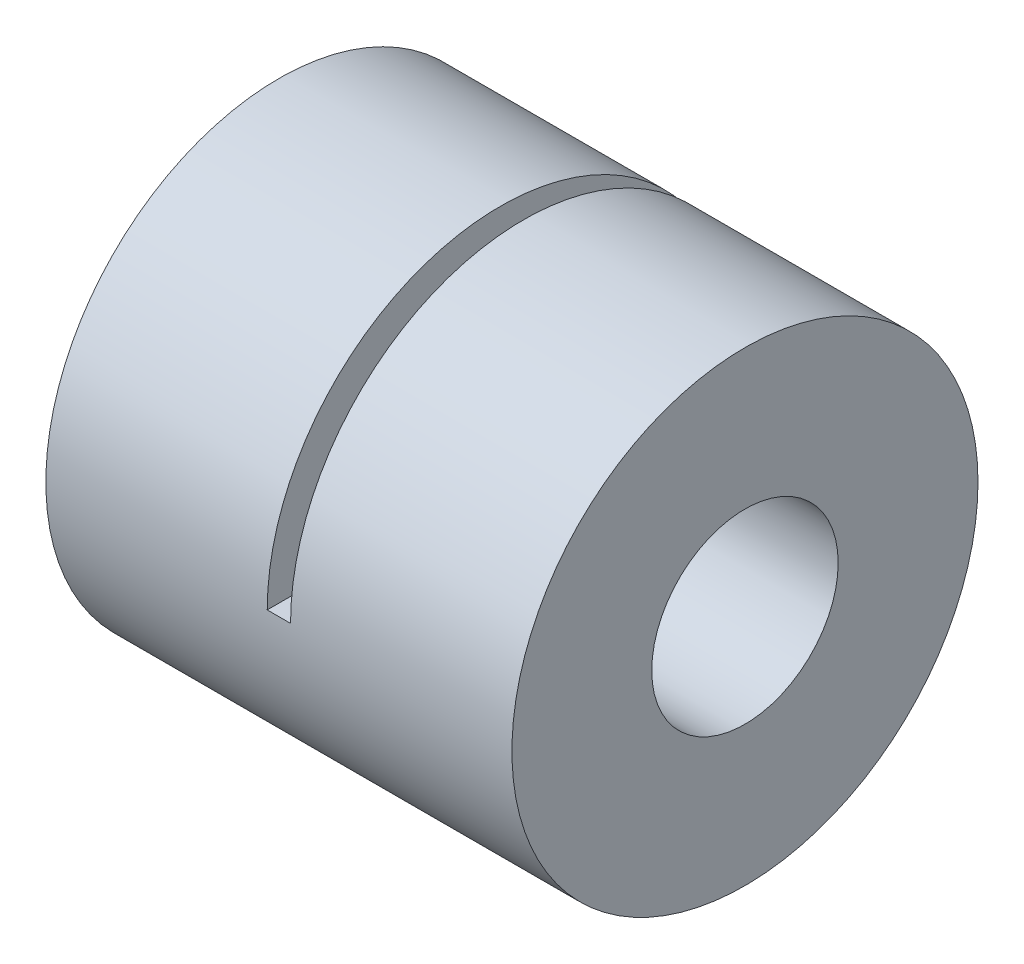
from build123d import *

# Parameters (mm, degrees)
SKETCH_1_R          = 10
SKETCH_1_R_2        = 4
EXTRUDE_1_DEPTH     = 20
SKETCH_2_W          = 1
SKETCH_2_H          = 20
CUT_EXTRUDE_1_DEPTH = 25.494897428


with BuildPart() as part:
    # ｽｹｯﾁ1 → ﾎﾞｽ - 押し出し1 (new body)
    with BuildSketch(Plane(origin=(0, 0, 0), x_dir=(0, 0, -1), z_dir=(1, 0, 0))):
        Circle(SKETCH_1_R)
        Circle(SKETCH_1_R_2, mode=Mode.SUBTRACT)
    extrude(amount=EXTRUDE_1_DEPTH)

    # ｽｹｯﾁ2 → ｶｯﾄ - 押し出し1 (cut, through all)
    with BuildSketch(Plane(origin=(0, 0, 0), x_dir=(1, 0, 0), z_dir=(0, 1, 0))):
        with Locations((10, 0)):
            Rectangle(SKETCH_2_W, SKETCH_2_H)
    extrude(amount=CUT_EXTRUDE_1_DEPTH, mode=Mode.SUBTRACT)


solid = part.part
